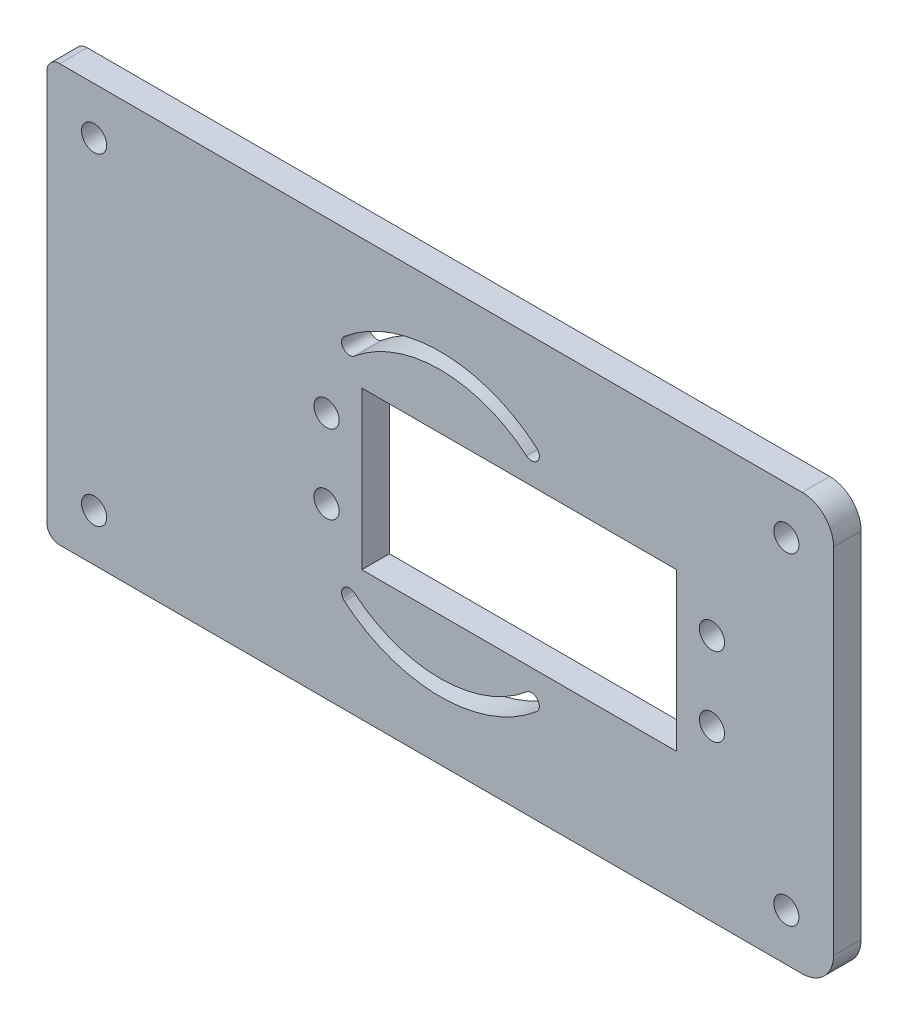
from build123d import *

# Parameters (mm, degrees)
SKETCH1_R           = 1.6
SKETCH1_W           = 40
SKETCH1_H           = 20
BOSS_EXTRUDE1_DEPTH = 3.5


with BuildPart() as part:
    # Sketch1 → Boss-Extrude1 (new body)
    with BuildSketch(Plane.XY):
        with BuildLine():
            ThreePointArc((-50.044200549, -24.884800983), (-49.571119709, -26.026919161), (-48.429001531, -26.5))
            Line((-48.429001531, -26.5), (45.955799451, -26.5))
            ThreePointArc((45.955799451, -26.5), (48.784226576, -25.328427125), (49.955799451, -22.5))
            Line((49.955799451, -22.5), (49.955799451, 22.5))
            ThreePointArc((49.955799451, 22.5), (48.784226576, 25.328427125), (45.955799451, 26.5))
            Line((45.955799451, 26.5), (-48.429001531, 26.5))
            ThreePointArc((-48.429001531, 26.5), (-49.571119709, 26.026919161), (-50.044200549, 24.884800983))
            Line((-50.044200549, 24.884800983), (-50.044200549, -24.884800983))
        make_face()
        with Locations((-44.044200549, -20.5)):
            Circle(SKETCH1_R, mode=Mode.SUBTRACT)
        with Locations((-14.5, -5)):
            Circle(SKETCH1_R, mode=Mode.SUBTRACT)
        with BuildLine():
            ThreePointArc((12.196121371, -14.531845007), (-0.008459876, -18.999966384), (-12.229764581, -14.57779233))
            ThreePointArc((-12.229764581, -14.57779233), (-12.355671334, -13.169194626), (-10.94707363, -13.043287874))
            ThreePointArc((-10.94707363, -13.043287874), (-0.012222052, -16.999969923), (10.907666432, -13.002177111))
            ThreePointArc((10.907666432, -13.002177111), (12.31672785, -13.122783589), (12.196121371, -14.531845007))
        make_face(mode=Mode.SUBTRACT)
        with Locations((43.955799451, -20.5)):
            Circle(SKETCH1_R, mode=Mode.SUBTRACT)
        with Locations((34.5, -5)):
            Circle(SKETCH1_R, mode=Mode.SUBTRACT)
        with Locations((-14.5, 5)):
            Circle(SKETCH1_R, mode=Mode.SUBTRACT)
        with Locations((-44.044200549, 20.5)):
            Circle(SKETCH1_R, mode=Mode.SUBTRACT)
        with Locations((10, 0)):
            Rectangle(SKETCH1_W, SKETCH1_H, mode=Mode.SUBTRACT)
        with Locations((34.5, 5)):
            Circle(SKETCH1_R, mode=Mode.SUBTRACT)
        with BuildLine():
            ThreePointArc((-10.94707363, 13.043287874), (-12.355671334, 13.169194626), (-12.229764581, 14.57779233))
            ThreePointArc((-12.229764581, 14.57779233), (-0.008459876, 18.999966384), (12.196121371, 14.531845007))
            ThreePointArc((12.196121371, 14.531845007), (12.31672785, 13.122783589), (10.907666432, 13.002177111))
            ThreePointArc((10.907666432, 13.002177111), (-0.012222052, 16.999969923), (-10.94707363, 13.043287874))
        make_face(mode=Mode.SUBTRACT)
        with Locations((43.955799451, 20.5)):
            Circle(SKETCH1_R, mode=Mode.SUBTRACT)
    extrude(amount=BOSS_EXTRUDE1_DEPTH)


solid = part.part
